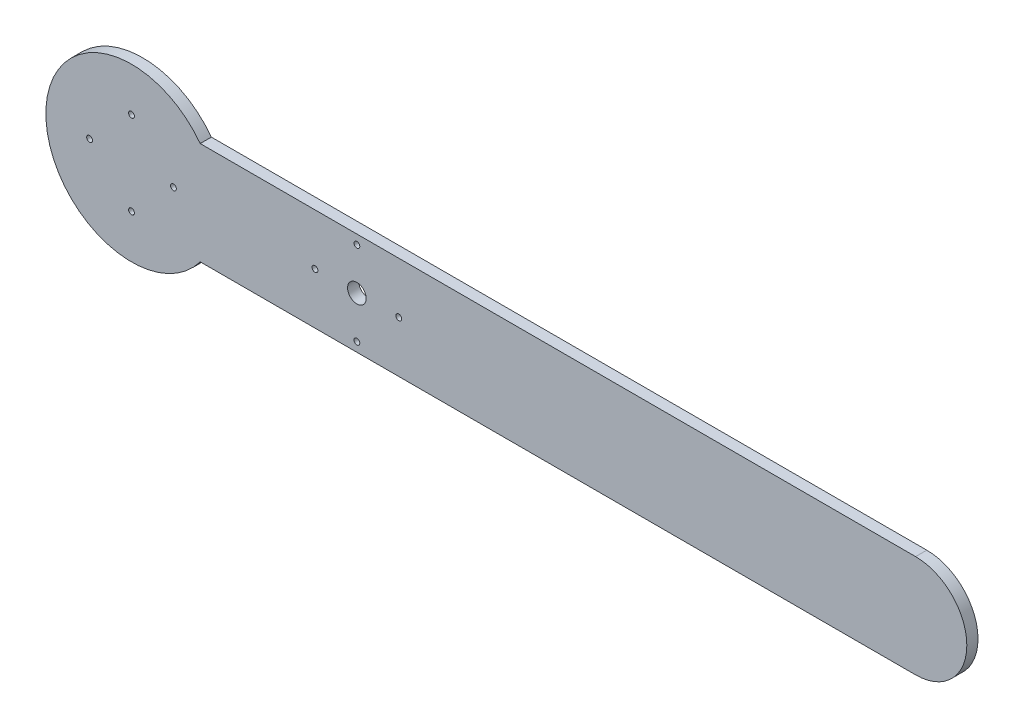
from build123d import *

# Parameters (mm, degrees)
BOSS_EXTRUDE1_START = 56.6115
SKETCH2_R           = 1.5635
SKETCH2_R_2         = 5
BOSS_EXTRUDE1_DEPTH = 6


with BuildPart() as part:
    # Sketch2 → Boss-Extrude1 (new body)
    with BuildSketch(Plane.XY.offset(BOSS_EXTRUDE1_START)):
        with BuildLine():
            Line((300, 27.5), (-84.125211865, 27.5))
            ThreePointArc((-84.125211865, 27.5), (-167, 0), (-84.125211865, -27.5))
            Line((-84.125211865, -27.5), (300, -27.5))
            ThreePointArc((300, -27.5), (327.5, 0), (300, 27.5))
        make_face()
        with Locations((0, 22.5)):
            Circle(SKETCH2_R, mode=Mode.SUBTRACT)
        with Locations((22.5, 0)):
            Circle(SKETCH2_R, mode=Mode.SUBTRACT)
        with Locations((0, -22.5)):
            Circle(SKETCH2_R, mode=Mode.SUBTRACT)
        with Locations((-22.5, 0)):
            Circle(SKETCH2_R, mode=Mode.SUBTRACT)
        with Locations((-121, -22.5)):
            Circle(SKETCH2_R, mode=Mode.SUBTRACT)
        with Locations((-143.5, 0)):
            Circle(SKETCH2_R, mode=Mode.SUBTRACT)
        with Locations((-121, 22.5)):
            Circle(SKETCH2_R, mode=Mode.SUBTRACT)
        with Locations((-98.5, 0)):
            Circle(SKETCH2_R, mode=Mode.SUBTRACT)
        Circle(SKETCH2_R_2, mode=Mode.SUBTRACT)
    extrude(amount=BOSS_EXTRUDE1_DEPTH)


solid = part.part
